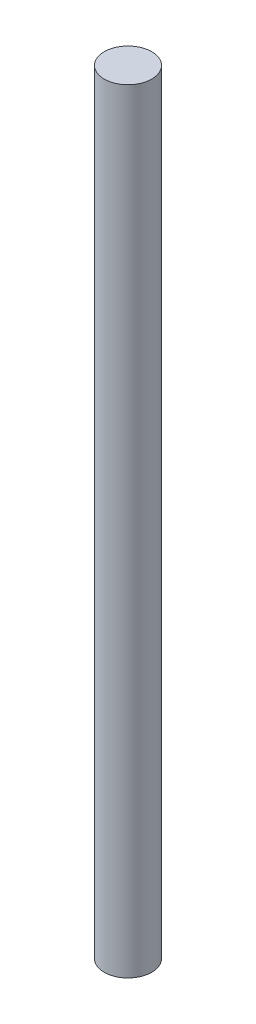
from build123d import *

# Parameters (mm, degrees)
SKETCH2_R = 6.75


with BuildPart() as part:
    # Sweep1: sweep along a path in Sketch1
    with BuildLine(Plane.XY) as sweep1_path:
        Line((0, 0), (0, 220))
    # Sketch2 → Sweep1 (sweep)
    with BuildSketch(Plane(origin=(0, 0, 0), x_dir=(1, 0, 0), z_dir=(0, 1, 0))):
        Circle(SKETCH2_R)
    sweep(path=sweep1_path.line)


solid = part.part
